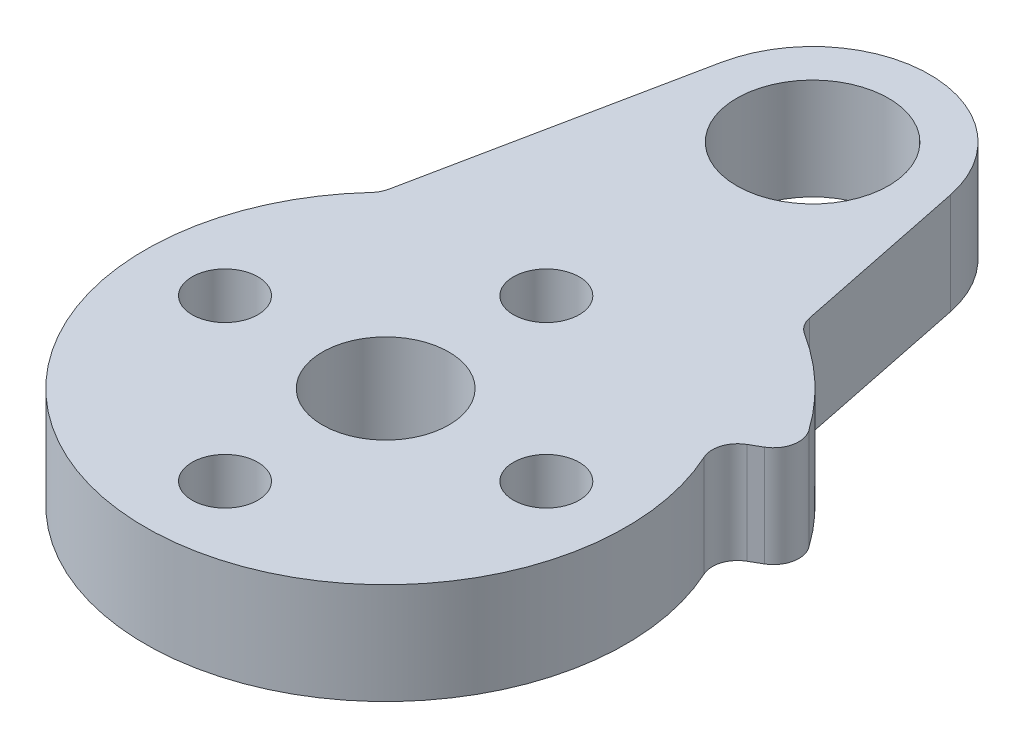
from build123d import *

# Parameters (mm, degrees)
SKETCH1_R           = 3
SKETCH1_R_2         = 2.5
BOSS_EXTRUDE1_DEPTH = 4
SKETCH2_R           = 1.3
CUT_EXTRUDE1_DEPTH  = 4
BOSS_EXTRUDE2_START = -4
BOSS_EXTRUDE2_DEPTH = 4
BOSS_EXTRUDE3_START = -4
BOSS_EXTRUDE3_DEPTH = 4
FILLET1_R           = 1


with BuildPart() as part:
    # Sketch1 → Boss-Extrude1 (new body)
    with BuildSketch(Plane(origin=(0, 0, 0), x_dir=(1, 0, 0), z_dir=(0, 1, 0))):
        with BuildLine():
            Line((-4.531642246, 17.7995776), (-7.838367177, 1.6))
            ThreePointArc((-7.838367177, 1.6), (0, -8), (7.838367177, 1.6))
            Line((7.838367177, 1.6), (4.531642246, 17.7995776))
            ThreePointArc((4.531642246, 17.7995776), (0, 21.499648), (-4.531642246, 17.7995776))
        make_face()
        with Locations(Location((0, 16.87456, 0), (0, 0, 270))):
            Circle(SKETCH1_R, mode=Mode.SUBTRACT)
        with Locations(Location((0, 0, 0), (0, 0, 270))):
            Circle(SKETCH1_R_2, mode=Mode.SUBTRACT)
    extrude(amount=BOSS_EXTRUDE1_DEPTH)

    # Sketch2 → Cut-Extrude1 (cut)
    with BuildSketch(Plane(origin=(0, 4, 0), x_dir=(1, 0, 0), z_dir=(0, 1, 0))):
        with Locations(Location((0, 6.35, 0), (0, 0, 270))):
            Circle(SKETCH2_R)
        with Locations(Location((6.35, 0, 0), (0, 0, 270))):
            Circle(SKETCH2_R)
        with Locations(Location((0, -6.35, 0), (0, 0, 270))):
            Circle(SKETCH2_R)
        with Locations(Location((-6.35, 0, 0), (0, 0, 270))):
            Circle(SKETCH2_R)
    extrude(amount=-CUT_EXTRUDE1_DEPTH, mode=Mode.SUBTRACT)

    # Sketch3 → Boss-Extrude2 (add)
    with BuildSketch(Plane(origin=(0, 4, 0), x_dir=(1, 0, 0), z_dir=(0, 1, 0)).offset(BOSS_EXTRUDE2_START)):
        with BuildLine():
            Line((-7.838367177, 1.6), (-6.8136721, 6.619960159))
            ThreePointArc((-6.8136721, 6.619960159), (0, -9.5), (6.8136721, 6.619960159))
            Line((6.8136721, 6.619960159), (7.838367177, 1.6))
            ThreePointArc((7.838367177, 1.6), (0, -8), (-7.838367177, 1.6))
        make_face()
    extrude(amount=BOSS_EXTRUDE2_DEPTH)

    # Sketch4 → Boss-Extrude3 (add)
    with BuildSketch(Plane(origin=(0, 4, 0), x_dir=(1, 0, 0), z_dir=(0, 1, 0)).offset(BOSS_EXTRUDE3_START)):
        with BuildLine():
            Line((8.227241336, 4.75), (10.392304845, 6))
            ThreePointArc((10.392304845, 6), (6, 10.392304845), (0, 12))
            Line((0, 12), (0, 9.5))
            ThreePointArc((0, 9.5), (4.75, 8.227241336), (8.227241336, 4.75))
        make_face()
    extrude(amount=BOSS_EXTRUDE3_DEPTH)

    # Fillet1
    fillet1_edges = [part.edges().sort_by_distance(p)[0] for p in [
        (-6.8136721, 2, -6.619960159),
        (6.049512795, 2, -10.36356092),
        (8.227241336, 2, -4.75),
        (10.392304845, 2, -6),
    ]]
    fillet(fillet1_edges, radius=FILLET1_R)


solid = part.part
